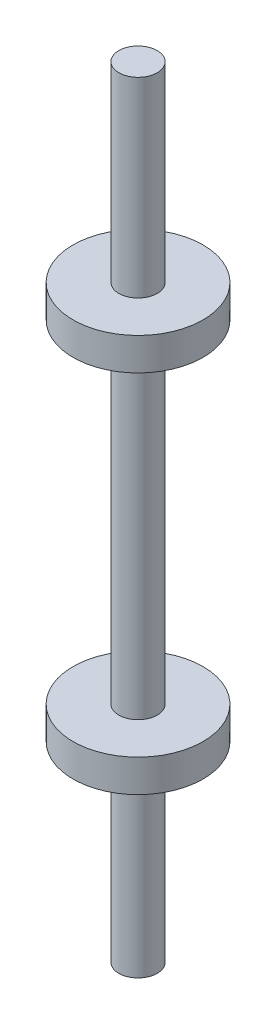
from build123d import *

# Parameters (mm, degrees)
SKETCH1_R           = 7.5
BOSS_EXTRUDE1_DEPTH = 304.8
SKETCH2_W           = 25.4
SKETCH2_H           = 12.7


with BuildPart() as part:
    # Sketch1 → Boss-Extrude1 (new body)
    with BuildSketch(Plane(origin=(0, 0, 0), x_dir=(1, 0, 0), z_dir=(0, 1, 0))):
        with Locations(Location((0, 0, 0), (0, 0, 90))):
            Circle(SKETCH1_R)
    extrude(amount=BOSS_EXTRUDE1_DEPTH)

    # Sketch2 → Revolve1 (revolve)
    with BuildSketch(Plane.XY, mode=Mode.PRIVATE) as revolve1_sk:
        with Locations((12.7, 223.75)):
            Rectangle(SKETCH2_W, SKETCH2_H)
        with Locations((12.7, 81.05)):
            Rectangle(SKETCH2_W, SKETCH2_H)
    revolve(revolve1_sk.sketch.rotate(Axis((0, 217.4, 0), (0, 1, 0)), 90), axis=Axis((0, 217.4, 0), (0, 1, 0)))


solid = part.part
